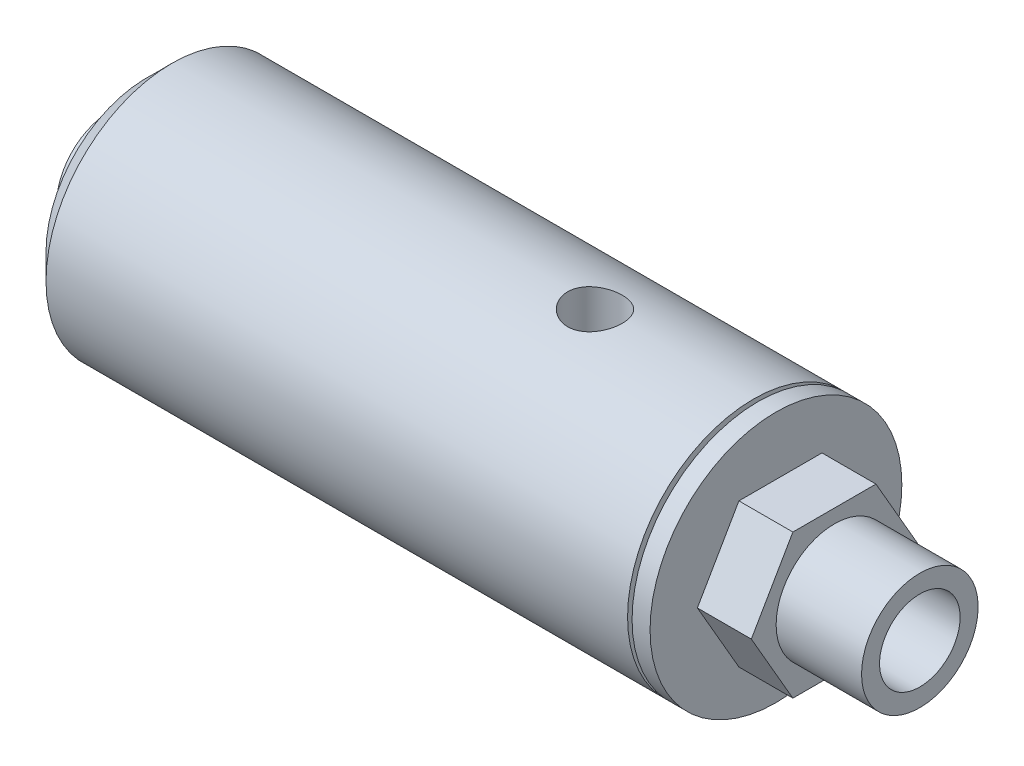
from build123d import *

# Parameters (mm, degrees)
CUT_EXTRUDE1_START = -5.0165
SKETCH2_R          = 8.745419401
CUT_EXTRUDE1_DEPTH = 5.0165
SKETCH3_R          = 2.413
CUT_EXTRUDE2_DEPTH = 11.557
SKETCH4_R          = 3.556
CUT_EXTRUDE3_DEPTH = 62.865


with BuildPart() as part:
    # Sketch1 → Revolve1 (revolve)
    with BuildSketch(Plane.XY, mode=Mode.PRIVATE) as revolve1_sk:
        Polygon((2.24506403, 11.1125), (0, 8.86743597), (0, 4.7625), (-3.175, 4.7625), (-3.175, 0), (0, 0), (55.5625, 0), (68.2625, 0), (68.2625, 5.1435), (60.721875, 5.1435), (60.721875, 8.745419401), (55.959375, 8.745419401), (55.959375, 4.7625), (55.5625, 4.7625), (55.5625, 11.1125), (53.975, 11.1125), (53.975, 10.004904014), (53.578125, 10.004904014), (53.578125, 11.1125), align=None)
    revolve(revolve1_sk.sketch.rotate(Axis((0, 0, 0), (1, 0, 0)), 90), axis=Axis((0, 0, 0), (1, 0, 0)))

    # Sketch2 → Cut-Extrude1 (cut)
    with BuildSketch(Plane(origin=(60.721875, 0, 0), x_dir=(0, 0, -1), z_dir=(1, 0, 0)).offset(CUT_EXTRUDE1_START)):
        Circle(SKETCH2_R)
        Polygon((-3.666174209, 6.35), (3.666174209, 6.35), (7.332348419, 0), (3.666174209, -6.35), (-3.666174209, -6.35), (-7.332348419, 0), align=None, mode=Mode.SUBTRACT)
    extrude(amount=CUT_EXTRUDE1_DEPTH, mode=Mode.SUBTRACT)

    # Sketch3 → Cut-Extrude2 (cut)
    with BuildSketch(Plane(origin=(0, 11.1125, 0), x_dir=(1, 0, 0), z_dir=(0, 1, 0))):
        with Locations(Location((39.590311937, 0, 0), (0, 0, 270))):
            Circle(SKETCH3_R)
    extrude(amount=-CUT_EXTRUDE2_DEPTH, mode=Mode.SUBTRACT)

    # Sketch4 → Cut-Extrude3 (cut)
    with BuildSketch(Plane(origin=(68.2625, 0, 0), x_dir=(0, 0, -1), z_dir=(1, 0, 0))):
        Circle(SKETCH4_R)
    extrude(amount=-CUT_EXTRUDE3_DEPTH, mode=Mode.SUBTRACT)


solid = part.part
